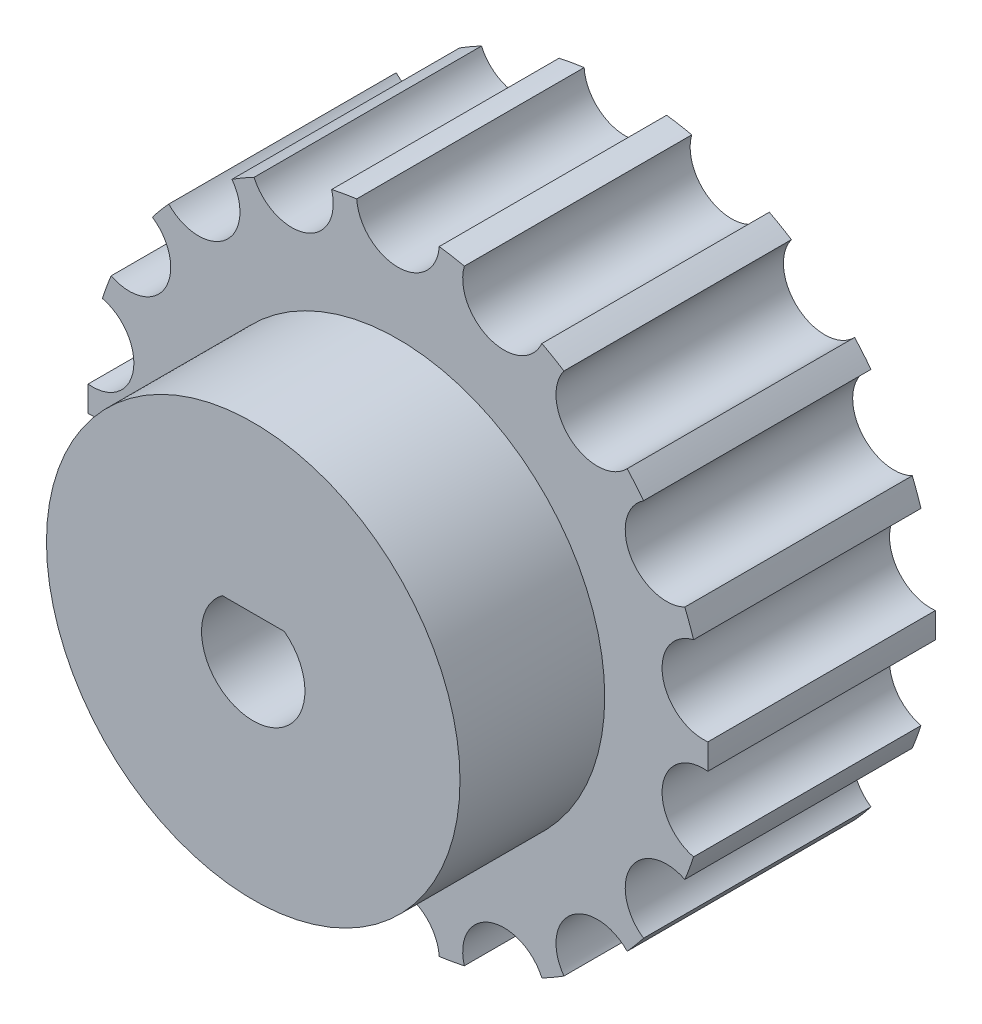
from build123d import *

# Parameters (mm, degrees)
SKETCH1_R           = 15
BOSS_EXTRUDE1_DEPTH = 11
SKETCH2_R           = 2
CUT_EXTRUDE1_DEPTH  = 11
SKETCH3_R           = 2.5
CUT_EXTRUDE2_DEPTH  = 11
BOSS_EXTRUDE2_START = 7
SKETCH5_R           = 10
SKETCH5_R_2         = 2.5
BOSS_EXTRUDE2_DEPTH = 7
BOSS_EXTRUDE3_DEPTH = 18


with BuildPart() as part:
    # Sketch1 → Boss-Extrude1 (new body)
    with BuildSketch(Plane.XY):
        Circle(SKETCH1_R)
    extrude(amount=BOSS_EXTRUDE1_DEPTH)

    # Sketch2 → Cut-Extrude1 (cut)
    with BuildSketch(Plane.XY.offset(11)):
        with Locations((0, 15)):
            Circle(SKETCH2_R)
        with Locations((5.13030215, 14.095389312)):
            Circle(SKETCH2_R)
        with Locations((9.641814145, 11.490666647)):
            Circle(SKETCH2_R)
        with Locations((12.990381057, 7.5)):
            Circle(SKETCH2_R)
        with Locations((14.772116295, 2.604722665)):
            Circle(SKETCH2_R)
        with Locations((14.772116295, -2.604722665)):
            Circle(SKETCH2_R)
        with Locations((12.990381057, -7.5)):
            Circle(SKETCH2_R)
        with Locations((9.641814145, -11.490666647)):
            Circle(SKETCH2_R)
        with Locations((5.13030215, -14.095389312)):
            Circle(SKETCH2_R)
        with Locations((0, -15)):
            Circle(SKETCH2_R)
        with Locations((-5.13030215, -14.095389312)):
            Circle(SKETCH2_R)
        with Locations((-9.641814145, -11.490666647)):
            Circle(SKETCH2_R)
        with Locations((-12.990381057, -7.5)):
            Circle(SKETCH2_R)
        with Locations((-14.772116295, -2.604722665)):
            Circle(SKETCH2_R)
        with Locations((-14.772116295, 2.604722665)):
            Circle(SKETCH2_R)
        with Locations((-12.990381057, 7.5)):
            Circle(SKETCH2_R)
        with Locations((-9.641814145, 11.490666647)):
            Circle(SKETCH2_R)
        with Locations((-5.13030215, 14.095389312)):
            Circle(SKETCH2_R)
    extrude(amount=-CUT_EXTRUDE1_DEPTH, mode=Mode.SUBTRACT)

    # Sketch3 → Cut-Extrude2 (cut)
    with BuildSketch(Plane.XY.offset(11)):
        Circle(SKETCH3_R)
    extrude(amount=-CUT_EXTRUDE2_DEPTH, mode=Mode.SUBTRACT)

    # Sketch5 → Boss-Extrude2 (add)
    with BuildSketch(Plane.XY.offset(11).offset(BOSS_EXTRUDE2_START)):
        Circle(SKETCH5_R)
        Circle(SKETCH5_R_2, mode=Mode.SUBTRACT)
    extrude(amount=-BOSS_EXTRUDE2_DEPTH)

    # Sketch6 → Boss-Extrude3 (add)
    with BuildSketch(Plane.XY.offset(18)):
        with BuildLine():
            Line((1.5, 2), (-1.5, 2))
            ThreePointArc((-1.5, 2), (0, 2.5), (1.5, 2))
        make_face()
    extrude(amount=-BOSS_EXTRUDE3_DEPTH)


solid = part.part
